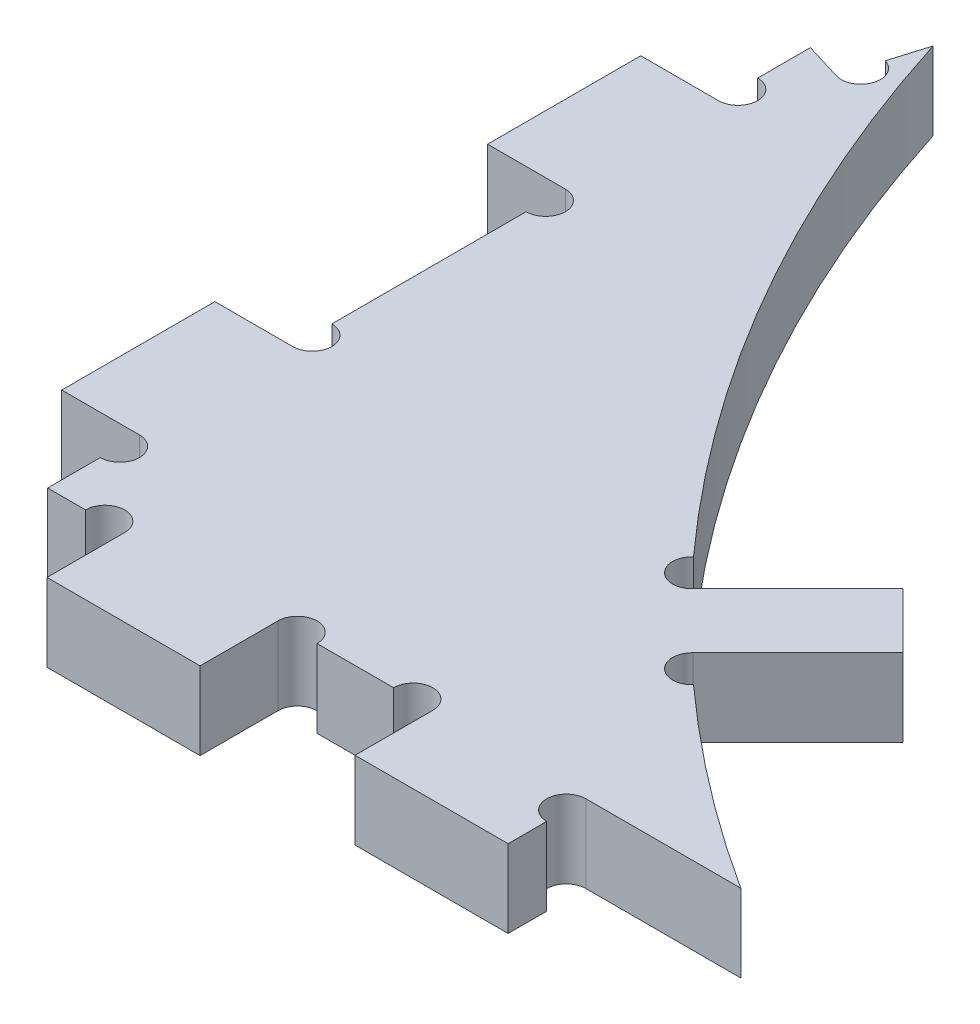
from build123d import *

# Parameters (mm, degrees)
BOSS_EXTRUDE1_DEPTH = 12.7
SKETCH2_R           = 3.2
CUT_EXTRUDE1_DEPTH  = 344.457619003


with BuildPart() as part:
    # Sketch1 → Boss-Extrude1 (new body)
    with BuildSketch(Plane(origin=(0, 0, 0), x_dir=(1, 0, 0), z_dir=(0, 1, 0))):
        with BuildLine():
            Line((-134.869381255, -210.5), (-160.156660352, -210.5))
            Line((-160.156660352, -210.5), (-160.156660352, -223.2))
            Line((-160.156660352, -223.2), (-185.156660352, -223.2))
            Line((-185.156660352, -223.2), (-185.156660352, -210.5))
            Line((-185.156660352, -210.5), (-210.446660352, -210.5))
            Line((-210.446660352, -210.5), (-210.446660352, -223.2))
            Line((-210.446660352, -223.2), (-235.446660352, -223.2))
            Line((-235.446660352, -223.2), (-235.446660352, -210.5))
            Line((-235.446660352, -210.5), (-248.036660352, -210.5))
            Line((-248.036660352, -210.5), (-248.036660352, -195.5))
            Line((-248.036660352, -195.5), (-260.736660352, -195.5))
            Line((-260.736660352, -195.5), (-260.736660352, -170.5))
            Line((-260.736660352, -170.5), (-248.036660352, -170.5))
            Line((-248.036660352, -170.5), (-248.036660352, -125.974827547))
            Line((-248.036660352, -125.974827547), (-260.736660352, -125.974827547))
            Line((-260.736660352, -125.974827547), (-260.736660352, -100.974827547))
            Line((-260.736660352, -100.974827547), (-248.036660352, -100.974827547))
            Line((-248.036660352, -100.974827547), (-248.036660352, -85.974827547))
            Line((-248.036660352, -85.974827547), (-241.932414551, -87.830328326))
            Line((-241.932414551, -87.830328326), (-238.254147431, -75.729526817))
            ThreePointArc((-238.254147431, -75.729526817), (-215.223229772, -127.196546204), (-181.244243015, -172.193276216))
            Line((-181.244243015, -172.193276216), (-163.978062557, -154.927095758))
            Line((-163.978062557, -154.927095758), (-154.927095758, -163.978062557))
            Line((-154.927095758, -163.978062557), (-172.193276216, -181.244243015))
            ThreePointArc((-172.193276216, -181.244243015), (-154.226598654, -196.759132616), (-134.869381255, -210.5))
        make_face()
    extrude(amount=BOSS_EXTRUDE1_DEPTH)

    # Sketch2 → Cut-Extrude1 (cut, through all)
    with BuildSketch(Plane(origin=(0, 12.7, 0), x_dir=(1, 0, 0), z_dir=(0, 1, 0))):
        with Locations((-248.036660352, -129.174827547)):
            Circle(SKETCH2_R)
        with Locations((-248.036660352, -97.774827547)):
            Circle(SKETCH2_R)
        with Locations((-248.036660352, -167.3)):
            Circle(SKETCH2_R)
        with Locations((-248.036660352, -198.7)):
            Circle(SKETCH2_R)
        with Locations((-238.646660352, -210.5)):
            Circle(SKETCH2_R)
        with Locations((-207.246660352, -210.5)):
            Circle(SKETCH2_R)
        with Locations((-188.356660352, -210.5)):
            Circle(SKETCH2_R)
        with Locations((-160.156660352, -213.7)):
            Circle(SKETCH2_R)
        with Locations((-183.433424282, -169.859291345)):
            Circle(SKETCH2_R)
        with Locations((-169.859291345, -183.433424282)):
            Circle(SKETCH2_R)
        with Locations((-241.001759282, -84.768648922)):
            Circle(SKETCH2_R)
    extrude(amount=-CUT_EXTRUDE1_DEPTH, mode=Mode.SUBTRACT)


solid = part.part
